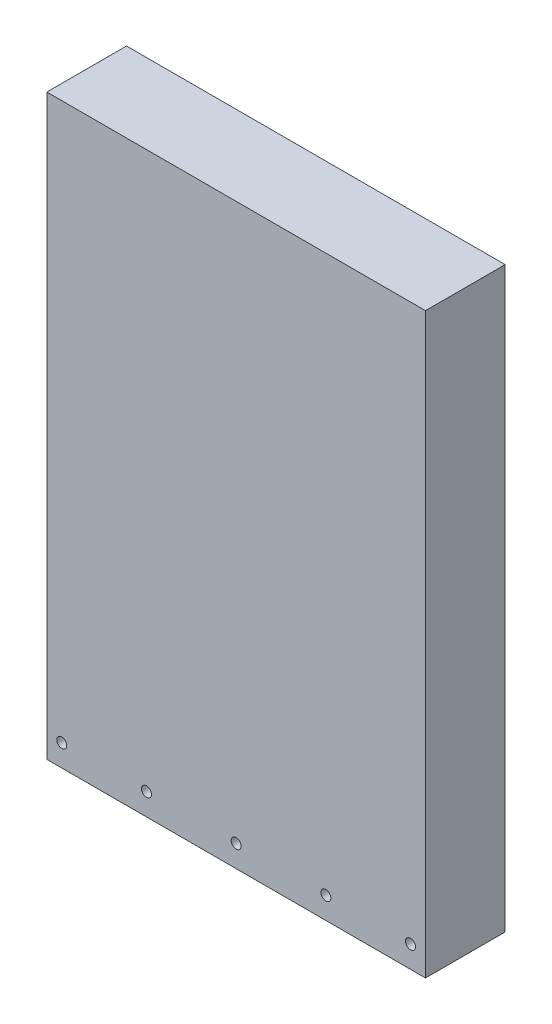
from build123d import *

# Parameters (mm, degrees)
ESBO_O1_W                = 190
ESBO_O1_H                = 290
ESBO_O1_W_2              = 180
ESBO_O1_H_2              = 280
RESSALTO_EXTRUS_O1_DEPTH = 40
ESBO_O2_W                = 180
ESBO_O2_H                = 280
RESSALTO_EXTRUS_O2_DEPTH = 25
RESSALTO_EXTRUS_O3_DEPTH = 15
ESBO_O5_R                = 0.75
RESSALTO_EXTRUS_O5_DEPTH = 15
ESBO_O7_R                = 1.25
RESSALTO_EXTRUS_O6_DEPTH = 1
RESSALTO_EXTRUS_O7_DEPTH = 15
FILETE1_R                = 1
ESBO_O11_R               = 2.5
CORTE_EXTRUS_O1_DEPTH    = 120
CORTE_EXTRUS_O2_START    = -10
ESBO_O12_R               = 2.5
CORTE_EXTRUS_O2_DEPTH    = 10
ESBO_O13_R               = 2.5
CORTE_EXTRUS_O3_DEPTH    = 10
ESBO_O14_R               = 2.5
CORTE_EXTRUS_O4_DEPTH    = 26


with BuildPart() as part:
    # Esboço1 → Ressalto-extrusão1 (new body)
    with BuildSketch(Plane.XY):
        with Locations((95, 145)):
            Rectangle(ESBO_O1_W, ESBO_O1_H)
        with Locations((95, 145)):
            Rectangle(ESBO_O1_W_2, ESBO_O1_H_2, mode=Mode.SUBTRACT)
    extrude(amount=RESSALTO_EXTRUS_O1_DEPTH)

    # Esboço2 → Ressalto-extrusão2 (add)
    with BuildSketch(Plane.XY.offset(40)):
        with Locations((95, 145)):
            Rectangle(ESBO_O2_W, ESBO_O2_H)
    extrude(amount=-RESSALTO_EXTRUS_O2_DEPTH)

    # Esboço4 → Ressalto-extrusão3 (add)
    with BuildSketch(Plane(origin=(0, 0, 15), x_dir=(-1, 0, 0), z_dir=(0, 0, -1))):
        with BuildLine():
            Line((-185, 5), (-175, 5))
            Line((-175, 5), (-175, 34.171572875))
            ThreePointArc((-175, 34.171572875), (-175.152240935, 34.93693974), (-175.585786438, 35.585786438))
            Line((-175.585786438, 35.585786438), (-185, 45))
            Line((-185, 45), (-185, 35))
            Line((-185, 35), (-185, 5))
        make_face()
        with BuildLine():
            Line((-150, 34.171572875), (-150, 5))
            Line((-150, 5), (-130, 5))
            Line((-130, 5), (-130, 34.171572875))
            ThreePointArc((-130, 34.171572875), (-130.152240935, 34.93693974), (-130.585786438, 35.585786438))
            Line((-130.585786438, 35.585786438), (-138.585786438, 43.585786438))
            ThreePointArc((-138.585786438, 43.585786438), (-140, 44.171572875), (-141.414213562, 43.585786438))
            Line((-141.414213562, 43.585786438), (-149.414213562, 35.585786438))
            ThreePointArc((-149.414213562, 35.585786438), (-149.847759065, 34.93693974), (-150, 34.171572875))
        make_face()
        with BuildLine():
            Line((-105, 34.171572875), (-105, 5))
            Line((-105, 5), (-85, 5))
            Line((-85, 5), (-85, 34.171572875))
            ThreePointArc((-85, 34.171572875), (-85.152240935, 34.93693974), (-85.585786438, 35.585786438))
            Line((-85.585786438, 35.585786438), (-93.585786438, 43.585786438))
            ThreePointArc((-93.585786438, 43.585786438), (-95, 44.171572875), (-96.414213562, 43.585786438))
            Line((-96.414213562, 43.585786438), (-104.414213562, 35.585786438))
            ThreePointArc((-104.414213562, 35.585786438), (-104.847759065, 34.93693974), (-105, 34.171572875))
        make_face()
        with BuildLine():
            Line((-60, 34.171572875), (-60, 5))
            Line((-60, 5), (-40, 5))
            Line((-40, 5), (-40, 34.171572875))
            ThreePointArc((-40, 34.171572875), (-40.152240935, 34.93693974), (-40.585786438, 35.585786438))
            Line((-40.585786438, 35.585786438), (-48.585786438, 43.585786438))
            ThreePointArc((-48.585786438, 43.585786438), (-50, 44.171572875), (-51.414213562, 43.585786438))
            Line((-51.414213562, 43.585786438), (-59.414213562, 35.585786438))
            ThreePointArc((-59.414213562, 35.585786438), (-59.847759065, 34.93693974), (-60, 34.171572875))
        make_face()
        with BuildLine():
            Line((-5, 35), (-5, 5))
            Line((-5, 5), (-15, 5))
            Line((-15, 5), (-15, 34.171572875))
            ThreePointArc((-15, 34.171572875), (-14.847759065, 34.93693974), (-14.414213562, 35.585786438))
            Line((-14.414213562, 35.585786438), (-5, 45))
            Line((-5, 45), (-5, 35))
        make_face()
    extrude(amount=RESSALTO_EXTRUS_O3_DEPTH)

    # Esboço5 → Ressalto-extrusão5 (add)
    with BuildSketch(Plane(origin=(0, 0, 0), x_dir=(-1, 0, 0), z_dir=(0, 0, -1))):
        with Locations((-167, 270)):
            Circle(ESBO_O5_R)
        with Locations((-131, 270)):
            Circle(ESBO_O5_R)
        with Locations((-95, 270)):
            Circle(ESBO_O5_R)
        with Locations((-59, 270)):
            Circle(ESBO_O5_R)
        with Locations((-23, 270)):
            Circle(ESBO_O5_R)
        with Locations((-41, 255)):
            Circle(ESBO_O5_R)
        with Locations((-77, 255)):
            Circle(ESBO_O5_R)
        with Locations((-113, 255)):
            Circle(ESBO_O5_R)
        with Locations((-149, 255)):
            Circle(ESBO_O5_R)
        with Locations((-167, 240)):
            Circle(ESBO_O5_R)
        with Locations((-131, 240)):
            Circle(ESBO_O5_R)
        with Locations((-95, 240)):
            Circle(ESBO_O5_R)
        with Locations((-59, 240)):
            Circle(ESBO_O5_R)
        with Locations((-23, 240)):
            Circle(ESBO_O5_R)
        with Locations((-149, 225)):
            Circle(ESBO_O5_R)
        with Locations((-113, 225)):
            Circle(ESBO_O5_R)
        with Locations((-77, 225)):
            Circle(ESBO_O5_R)
        with Locations((-41, 225)):
            Circle(ESBO_O5_R)
        with Locations((-167, 210)):
            Circle(ESBO_O5_R)
        with Locations((-131, 210)):
            Circle(ESBO_O5_R)
        with Locations((-95, 210)):
            Circle(ESBO_O5_R)
        with Locations((-59, 210)):
            Circle(ESBO_O5_R)
        with Locations((-23, 210)):
            Circle(ESBO_O5_R)
        with Locations((-149, 195)):
            Circle(ESBO_O5_R)
        with Locations((-113, 195)):
            Circle(ESBO_O5_R)
        with Locations((-77, 195)):
            Circle(ESBO_O5_R)
        with Locations((-41, 195)):
            Circle(ESBO_O5_R)
        with Locations((-23, 180)):
            Circle(ESBO_O5_R)
        with Locations((-59, 180)):
            Circle(ESBO_O5_R)
        with Locations((-95, 180)):
            Circle(ESBO_O5_R)
        with Locations((-131, 180)):
            Circle(ESBO_O5_R)
        with Locations((-167, 180)):
            Circle(ESBO_O5_R)
        with Locations((-149, 165)):
            Circle(ESBO_O5_R)
        with Locations((-113, 165)):
            Circle(ESBO_O5_R)
        with Locations((-77, 165)):
            Circle(ESBO_O5_R)
        with Locations((-41, 165)):
            Circle(ESBO_O5_R)
        with Locations((-23, 150)):
            Circle(ESBO_O5_R)
        with Locations((-59, 150)):
            Circle(ESBO_O5_R)
        with Locations((-95, 150)):
            Circle(ESBO_O5_R)
        with Locations((-131, 150)):
            Circle(ESBO_O5_R)
        with Locations((-167, 150)):
            Circle(ESBO_O5_R)
        with Locations((-149, 135)):
            Circle(ESBO_O5_R)
        with Locations((-113, 135)):
            Circle(ESBO_O5_R)
        with Locations((-77, 135)):
            Circle(ESBO_O5_R)
        with Locations((-41, 135)):
            Circle(ESBO_O5_R)
        with Locations((-167, 120)):
            Circle(ESBO_O5_R)
        with Locations((-131, 120)):
            Circle(ESBO_O5_R)
        with Locations((-95.015926137, 120)):
            Circle(ESBO_O5_R)
        with Locations((-59, 120)):
            Circle(ESBO_O5_R)
        with Locations((-23, 120)):
            Circle(ESBO_O5_R)
        with Locations((-41, 105)):
            Circle(ESBO_O5_R)
        with Locations((-77, 105)):
            Circle(ESBO_O5_R)
        with Locations((-113, 105)):
            Circle(ESBO_O5_R)
        with Locations((-149, 105)):
            Circle(ESBO_O5_R)
        with Locations((-167, 90)):
            Circle(ESBO_O5_R)
        with Locations((-149, 75)):
            Circle(ESBO_O5_R)
        with Locations((-131, 90)):
            Circle(ESBO_O5_R)
        with Locations((-113, 75)):
            Circle(ESBO_O5_R)
        with Locations((-95, 90)):
            Circle(ESBO_O5_R)
        with Locations((-77, 75)):
            Circle(ESBO_O5_R)
        with Locations((-59, 90)):
            Circle(ESBO_O5_R)
        with Locations((-41, 75)):
            Circle(ESBO_O5_R)
        with Locations((-23, 90)):
            Circle(ESBO_O5_R)
        with Locations((-23, 60)):
            Circle(ESBO_O5_R)
        with Locations((-59, 60)):
            Circle(ESBO_O5_R)
        with Locations((-95, 60)):
            Circle(ESBO_O5_R)
        with Locations((-131, 60)):
            Circle(ESBO_O5_R)
        with Locations((-167, 60)):
            Circle(ESBO_O5_R)
    extrude(amount=-RESSALTO_EXTRUS_O5_DEPTH)

    # Esboço7 → Ressalto-extrusão6 (add)
    with BuildSketch(Plane(origin=(0, 0, 0), x_dir=(-1, 0, 0), z_dir=(0, 0, -1))):
        with Locations((-167, 270)):
            Circle(ESBO_O7_R)
        with Locations((-149, 255)):
            Circle(ESBO_O7_R)
        with Locations((-131, 270)):
            Circle(ESBO_O7_R)
        with Locations((-113, 255)):
            Circle(ESBO_O7_R)
        with Locations((-95, 270)):
            Circle(ESBO_O7_R)
        with Locations((-59, 270)):
            Circle(ESBO_O7_R)
        with Locations((-23, 270)):
            Circle(ESBO_O7_R)
        with Locations((-77, 255)):
            Circle(ESBO_O7_R)
        with Locations((-41, 255)):
            Circle(ESBO_O7_R)
        with Locations((-23, 240)):
            Circle(ESBO_O7_R)
        with Locations((-59, 240)):
            Circle(ESBO_O7_R)
        with Locations((-77, 225)):
            Circle(ESBO_O7_R)
        with Locations((-41, 225)):
            Circle(ESBO_O7_R)
        with Locations((-95, 240)):
            Circle(ESBO_O7_R)
        with Locations((-113, 225)):
            Circle(ESBO_O7_R)
        with Locations((-167, 240)):
            Circle(ESBO_O7_R)
        with Locations((-149, 225)):
            Circle(ESBO_O7_R)
        with Locations((-131, 240)):
            Circle(ESBO_O7_R)
        with Locations((-131, 210)):
            Circle(ESBO_O7_R)
        with Locations((-167, 210)):
            Circle(ESBO_O7_R)
        with Locations((-149, 195)):
            Circle(ESBO_O7_R)
        with Locations((-167, 180)):
            Circle(ESBO_O7_R)
        with Locations((-131, 180)):
            Circle(ESBO_O7_R)
        with Locations((-113, 195)):
            Circle(ESBO_O7_R)
        with Locations((-95, 210)):
            Circle(ESBO_O7_R)
        with Locations((-77, 195)):
            Circle(ESBO_O7_R)
        with Locations((-95, 180)):
            Circle(ESBO_O7_R)
        with Locations((-77, 165)):
            Circle(ESBO_O7_R)
        with Locations((-59, 180)):
            Circle(ESBO_O7_R)
        with Locations((-59, 210)):
            Circle(ESBO_O7_R)
        with Locations((-23, 210)):
            Circle(ESBO_O7_R)
        with Locations((-41, 195)):
            Circle(ESBO_O7_R)
        with Locations((-23, 180)):
            Circle(ESBO_O7_R)
        with Locations((-41, 165)):
            Circle(ESBO_O7_R)
        with Locations((-23, 150)):
            Circle(ESBO_O7_R)
        with Locations((-41, 135)):
            Circle(ESBO_O7_R)
        with Locations((-59, 150)):
            Circle(ESBO_O7_R)
        with Locations((-23, 120)):
            Circle(ESBO_O7_R)
        with Locations((-59, 120)):
            Circle(ESBO_O7_R)
        with Locations((-113, 165)):
            Circle(ESBO_O7_R)
        with Locations((-149, 165)):
            Circle(ESBO_O7_R)
        with Locations((-131, 150)):
            Circle(ESBO_O7_R)
        with Locations((-167, 150)):
            Circle(ESBO_O7_R)
        with Locations((-149, 135)):
            Circle(ESBO_O7_R)
        with Locations((-113, 135)):
            Circle(ESBO_O7_R)
        with Locations((-95, 150)):
            Circle(ESBO_O7_R)
        with Locations((-95.015926137, 120)):
            Circle(ESBO_O7_R)
        with Locations((-77, 135)):
            Circle(ESBO_O7_R)
        with Locations((-167, 120)):
            Circle(ESBO_O7_R)
        with Locations((-149, 105)):
            Circle(ESBO_O7_R)
        with Locations((-131, 120)):
            Circle(ESBO_O7_R)
        with Locations((-167, 90)):
            Circle(ESBO_O7_R)
        with Locations((-131, 90)):
            Circle(ESBO_O7_R)
        with Locations((-95, 90)):
            Circle(ESBO_O7_R)
        with Locations((-113, 105)):
            Circle(ESBO_O7_R)
        with Locations((-59, 90)):
            Circle(ESBO_O7_R)
        with Locations((-77, 105)):
            Circle(ESBO_O7_R)
        with Locations((-41, 105)):
            Circle(ESBO_O7_R)
        with Locations((-23, 90)):
            Circle(ESBO_O7_R)
        with Locations((-41, 75)):
            Circle(ESBO_O7_R)
        with Locations((-77, 75)):
            Circle(ESBO_O7_R)
        with Locations((-23, 60)):
            Circle(ESBO_O7_R)
        with Locations((-59, 60)):
            Circle(ESBO_O7_R)
        with Locations((-167, 60)):
            Circle(ESBO_O7_R)
        with Locations((-149, 75)):
            Circle(ESBO_O7_R)
        with Locations((-131, 60)):
            Circle(ESBO_O7_R)
        with Locations((-113, 75)):
            Circle(ESBO_O7_R)
        with Locations((-95, 60)):
            Circle(ESBO_O7_R)
    extrude(amount=-RESSALTO_EXTRUS_O6_DEPTH)

    # Esboço8 → Ressalto-extrusão7 (add)
    with BuildSketch(Plane(origin=(0, 0, 15), x_dir=(-1, 0, 0), z_dir=(0, 0, -1))):
        Polygon((-185, 195), (-175, 195), (-185, 210), align=None)
        Polygon((-185, 105), (-175, 105), (-185, 120), align=None)
        Polygon((-5, 105), (-15, 105), (-5, 120), align=None)
        Polygon((-5, 195), (-15, 195), (-5, 210), align=None)
    extrude(amount=RESSALTO_EXTRUS_O7_DEPTH)

    # Filete1
    filete1_edges = [part.edges().sort_by_distance(p)[0] for p in [
        (175, 195, 7.5),
        (175, 105, 7.5),
        (15, 105, 7.5),
        (15, 195, 7.5),
    ]]
    fillet(filete1_edges, radius=FILETE1_R)

    # Esboço11 → Corte-extrusão1 (cut)
    with BuildSketch(Plane(origin=(150, 0, 0), x_dir=(0, 0, -1), z_dir=(1, 0, 0))):
        with Locations(Location((-8, 11, 0), (0, 0, 270))):
            Circle(ESBO_O11_R)
    extrude(amount=-CORTE_EXTRUS_O1_DEPTH, mode=Mode.SUBTRACT)

    # Esboço12 → Corte-extrusão2 (cut)
    with BuildSketch(Plane.ZY.offset(-175).offset(CORTE_EXTRUS_O2_START)):
        with Locations(Location((8, 11, 0), (0, 0, 270))):
            Circle(ESBO_O12_R)
    extrude(amount=CORTE_EXTRUS_O2_DEPTH, mode=Mode.SUBTRACT)

    # Esboço13 → Corte-extrusão3 (cut)
    with BuildSketch(Plane(origin=(15, 0, 0), x_dir=(0, 0, -1), z_dir=(1, 0, 0))):
        with Locations(Location((-8, 11, 0), (0, 0, 270))):
            Circle(ESBO_O13_R)
    extrude(amount=-CORTE_EXTRUS_O3_DEPTH, mode=Mode.SUBTRACT)

    # Esboço14 → Corte-extrusão4 (cut)
    with BuildSketch(Plane.XY.offset(40)):
        with Locations((7.5, 11)):
            Circle(ESBO_O14_R)
        with Locations((50, 11)):
            Circle(ESBO_O14_R)
        with Locations((95, 11)):
            Circle(ESBO_O14_R)
        with Locations((140, 11)):
            Circle(ESBO_O14_R)
        with Locations((182.5, 11)):
            Circle(ESBO_O14_R)
    extrude(amount=-CORTE_EXTRUS_O4_DEPTH, mode=Mode.SUBTRACT)


solid = part.part
